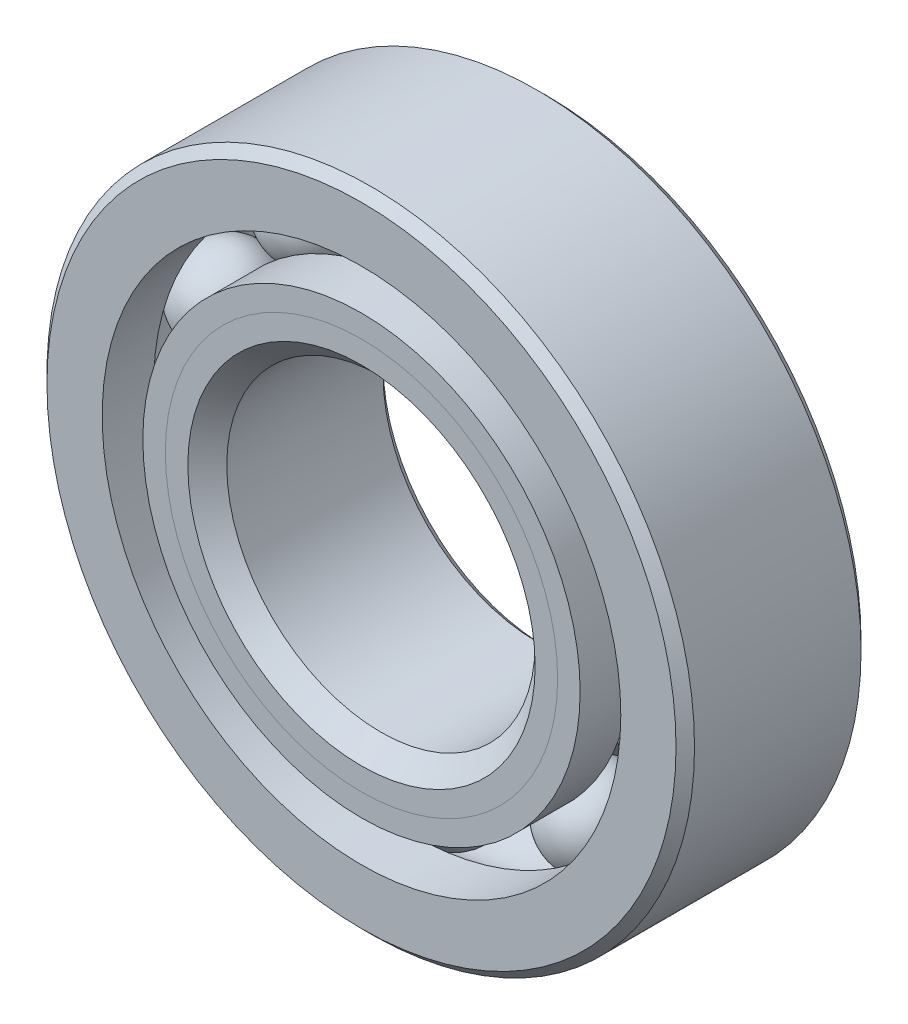
from build123d import *

# Parameters (mm, degrees)
CIRPATTERN1_COUNT = 10


with BuildPart() as part:
    # Sketch1 → Revolve1 (revolve)
    with BuildSketch(Plane(origin=(0, 0, 0), x_dir=(0, 0, -1), z_dir=(1, 0, 0))):
        with BuildLine():
            Line((5.4, 21), (-5.4, 21))
            Line((-5.4, 21), (-6, 20.4))
            Line((-6, 20.4), (-6, 16.818681319))
            Line((-6, 16.818681319), (-2.666666667, 16.818681319))
            ThreePointArc((-2.666666667, 16.818681319), (0, 18.474900256), (2.666666667, 16.818681319))
            Line((2.666666667, 16.818681319), (6, 16.818681319))
            Line((6, 16.818681319), (6, 20.4))
            Line((6, 20.4), (5.4, 21))
        make_face()
    revolve(axis=Axis((0, 0, 6), (0, 0, -1)))


with BuildPart() as body_2:
    # Sketch2 → Revolve2 (revolve)
    with BuildSketch(Plane(origin=(0, 0, 0), x_dir=(0, 0, -1), z_dir=(1, 0, 0))):
        with BuildLine():
            Line((-6, 14.181318681), (-2.666666667, 14.181318681))
            ThreePointArc((-2.666666667, 14.181318681), (-1.569567797, 12.972849735), (0, 12.525099744))
            Line((0, 12.525099744), (0, 11.262549872))
            Line((0, 11.262549872), (-4.540615595, 11.262549872))
            Line((-4.540615595, 11.262549872), (-6, 12.721934277))
            Line((-6, 12.721934277), (-6, 14.181318681))
        make_face()
    revolve(axis=Axis((0, 0, 6), (0, 0, -1)))


with BuildPart() as body_3:
    # Sketch3 → Revolve3 (revolve)
    with BuildSketch(Plane(origin=(0, 0, 0), x_dir=(0, 0, -1), z_dir=(1, 0, 0))):
        with BuildLine():
            Line((-6, 12.721934277), (-4.540615595, 11.262549872))
            Line((-4.540615595, 11.262549872), (0, 11.262549872))
            Line((0, 11.262549872), (0, 12.525099744))
            ThreePointArc((0, 12.525099744), (1.569567797, 12.972849735), (2.666666667, 14.181318681))
            Line((2.666666667, 14.181318681), (6, 14.181318681))
            Line((6, 14.181318681), (6, 10.6))
            Line((6, 10.6), (5.4, 10))
            Line((5.4, 10), (-4.737450128, 10))
            Line((-4.737450128, 10), (-6, 11.262549872))
            Line((-6, 11.262549872), (-6, 12.721934277))
        make_face()
    revolve(axis=Axis((0, 0, 6), (0, 0, -1)))


with BuildPart() as body_4:
    # Sketch4 → Revolve4 (revolve)
    with BuildSketch(Plane(origin=(0, 0, 0), x_dir=(0, 0, -1), z_dir=(1, 0, 0))):
        with BuildLine():
            Line((-2.974900256, 15.5), (2.974900256, 15.5))
            ThreePointArc((2.974900256, 15.5), (0, 18.474900256), (-2.974900256, 15.5))
        make_face()
    revolve(axis=Axis((0, 15.5, 2.974900256), (0, 0, -1)))


with BuildPart() as cirpattern1_1:
    # CirPattern1: pattern copy
    add(body_4.part.rotate(Axis((0, 0, -6), (0, 0, 1)), 1 * 360 / CIRPATTERN1_COUNT))


with BuildPart() as cirpattern1_2:
    # CirPattern1: pattern copy
    add(body_4.part.rotate(Axis((0, 0, -6), (0, 0, 1)), 2 * 360 / CIRPATTERN1_COUNT))


with BuildPart() as cirpattern1_3:
    # CirPattern1: pattern copy
    add(body_4.part.rotate(Axis((0, 0, -6), (0, 0, 1)), 3 * 360 / CIRPATTERN1_COUNT))


with BuildPart() as cirpattern1_4:
    # CirPattern1: pattern copy
    add(body_4.part.rotate(Axis((0, 0, -6), (0, 0, 1)), 4 * 360 / CIRPATTERN1_COUNT))


with BuildPart() as cirpattern1_5:
    # CirPattern1: pattern copy
    add(body_4.part.rotate(Axis((0, 0, -6), (0, 0, 1)), 5 * 360 / CIRPATTERN1_COUNT))


with BuildPart() as cirpattern1_6:
    # CirPattern1: pattern copy
    add(body_4.part.rotate(Axis((0, 0, -6), (0, 0, 1)), 6 * 360 / CIRPATTERN1_COUNT))


with BuildPart() as cirpattern1_7:
    # CirPattern1: pattern copy
    add(body_4.part.rotate(Axis((0, 0, -6), (0, 0, 1)), 7 * 360 / CIRPATTERN1_COUNT))


with BuildPart() as cirpattern1_8:
    # CirPattern1: pattern copy
    add(body_4.part.rotate(Axis((0, 0, -6), (0, 0, 1)), 8 * 360 / CIRPATTERN1_COUNT))


with BuildPart() as cirpattern1_9:
    # CirPattern1: pattern copy
    add(body_4.part.rotate(Axis((0, 0, -6), (0, 0, 1)), 9 * 360 / CIRPATTERN1_COUNT))


solid = Compound([part.part, body_2.part, body_3.part, body_4.part, cirpattern1_1.part, cirpattern1_2.part, cirpattern1_3.part, cirpattern1_4.part, cirpattern1_5.part, cirpattern1_6.part, cirpattern1_7.part, cirpattern1_8.part, cirpattern1_9.part])
